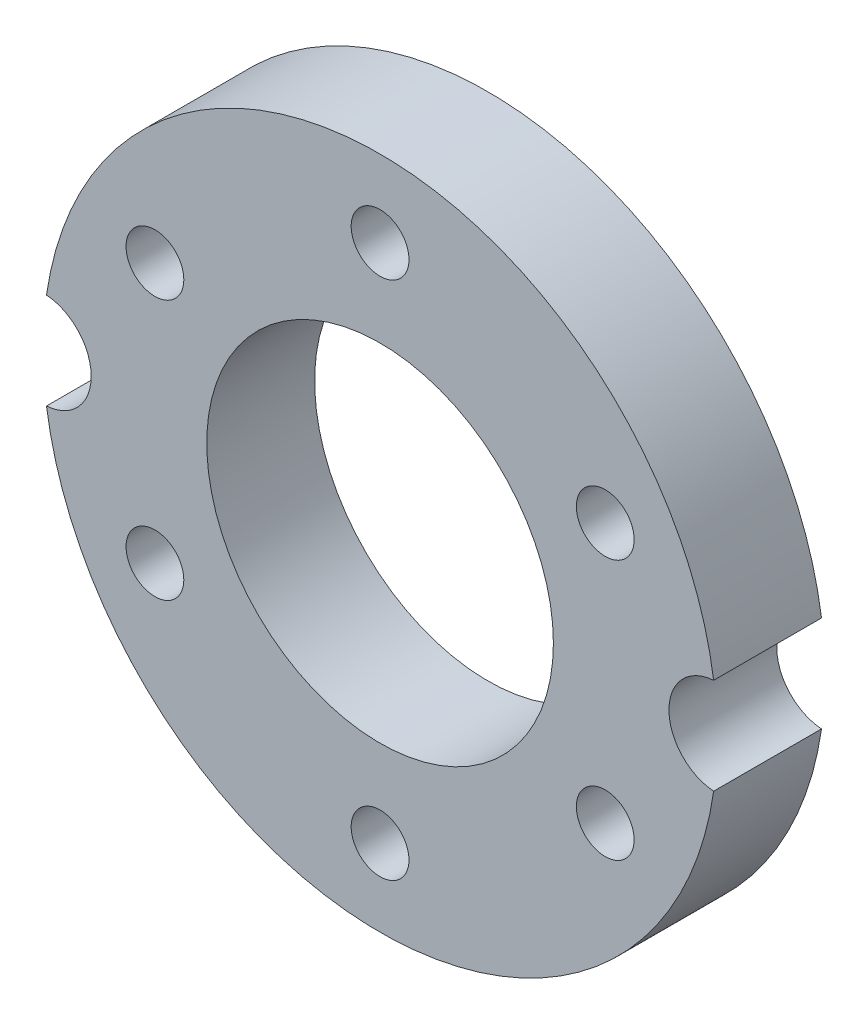
from build123d import *

# Parameters (mm, degrees)
SKETCH_1_R      = 1.5
EXTRUDE_1_DEPTH = 5.6


with BuildPart() as part:
    # 草图1 → 凸台-拉伸1 (new body)
    with BuildSketch(Plane.XY):
        with BuildLine():
            ThreePointArc((-17.321428571, -2.493614294), (-11.45887756, -13.226644513), (0, -17.5))
            ThreePointArc((0, -17.5), (11.45887756, -13.226644513), (17.321428571, -2.493614294))
            ThreePointArc((17.321428571, -2.493614294), (15, 0), (17.321428571, 2.493614294))
            ThreePointArc((17.321428571, 2.493614294), (0, 17.5), (-17.321428571, 2.493614294))
            ThreePointArc((-17.321428571, 2.493614294), (-15.670187363, 1.70346286), (-15, 0))
            ThreePointArc((-15, 0), (-15.670187363, -1.70346286), (-17.321428571, -2.493614294))
        make_face()
        with Locations((-11.691342951, -6.75)):
            Circle(SKETCH_1_R, mode=Mode.SUBTRACT)
        with BuildLine():
            ThreePointArc((0, -15), (-1.5, -13.5), (0, -12))
            ThreePointArc((0, -12), (1.060660172, -12.439339828), (1.5, -13.5))
            ThreePointArc((1.5, -13.5), (1.060660172, -14.560660172), (0, -15))
        make_face(mode=Mode.SUBTRACT)
        with Locations((11.691342951, -6.75)):
            Circle(SKETCH_1_R, mode=Mode.SUBTRACT)
        with Locations((-11.691342951, 6.75)):
            Circle(SKETCH_1_R, mode=Mode.SUBTRACT)
        with BuildLine():
            ThreePointArc((9, 0), (6.363961031, -6.363961031), (0, -9))
            ThreePointArc((0, -9), (-6.363961031, 6.363961031), (9, 0))
        make_face(mode=Mode.SUBTRACT)
        with Locations((11.691342951, 6.75)):
            Circle(SKETCH_1_R, mode=Mode.SUBTRACT)
        with Locations((0, 13.5)):
            Circle(SKETCH_1_R, mode=Mode.SUBTRACT)
    extrude(amount=EXTRUDE_1_DEPTH)


solid = part.part
